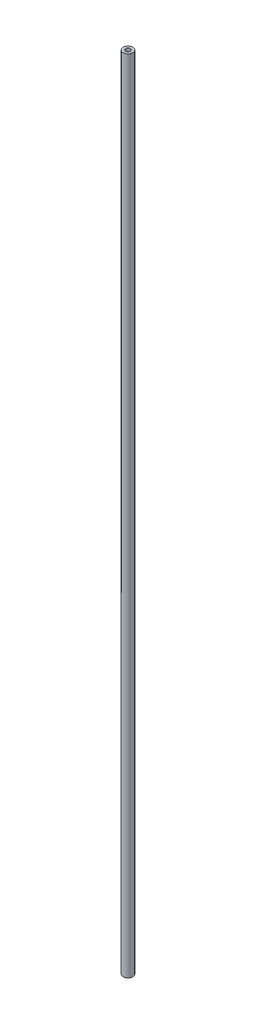
from build123d import *

# Parameters (mm, degrees)
SKETCH1_R           = 3
SKETCH1_R_2         = 1.5
BOSS_EXTRUDE1_DEPTH = 499.999999998


with BuildPart() as part:
    # Sketch1 → Boss-Extrude1 (new body)
    with BuildSketch(Plane(origin=(0, 0, 0), x_dir=(1, 0, 0), z_dir=(0, 1, 0))):
        with Locations(Location((0, 0, 0), (0, 0, 270))):
            Circle(SKETCH1_R)
        with Locations(Location((0, 0, 0), (0, 0, 270))):
            Circle(SKETCH1_R_2, mode=Mode.SUBTRACT)
    extrude(amount=BOSS_EXTRUDE1_DEPTH)


solid = part.part
